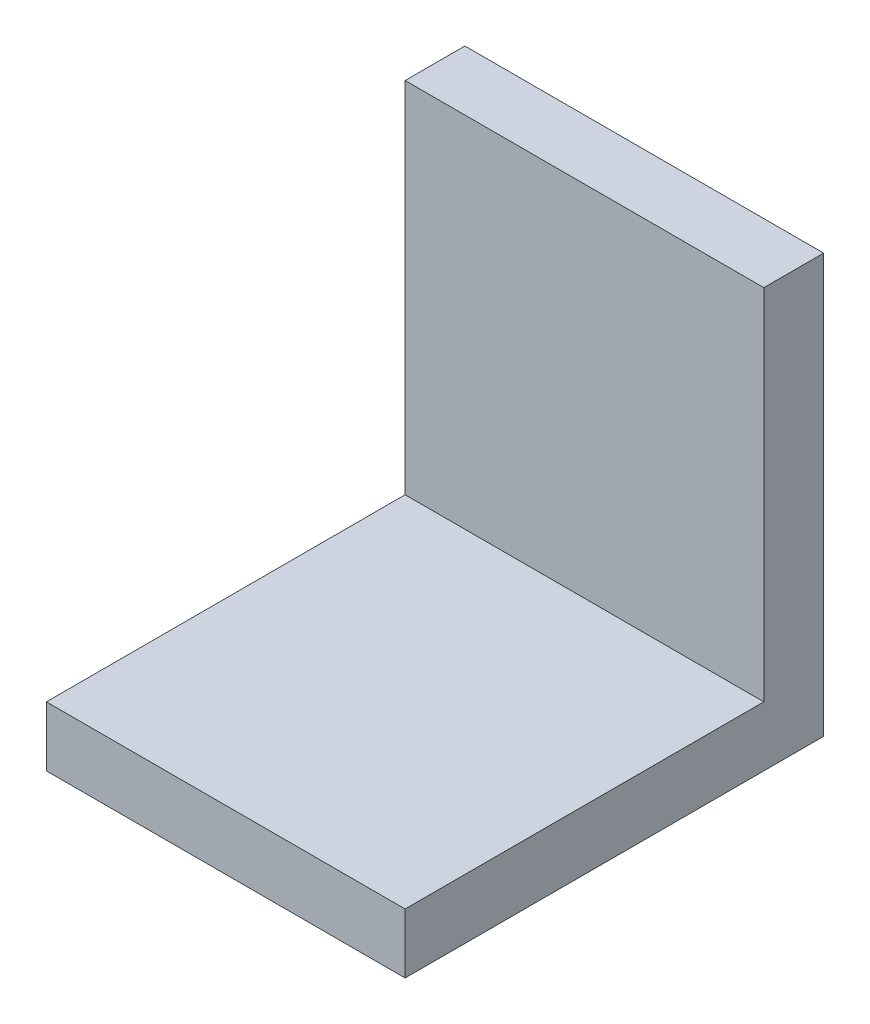
from build123d import *

# Parameters (mm, degrees)
BOSS_EXTRUDE1_DEPTH = 30


with BuildPart() as part:
    # Sketch1 → Boss-Extrude1 (new body)
    with BuildSketch(Plane(origin=(0, 0, 0), x_dir=(0, 0, -1), z_dir=(1, 0, 0))):
        Polygon((0, 0), (-35, 0), (-35, 5), (-5, 5), (-5, 35), (0, 35), align=None)
    extrude(amount=BOSS_EXTRUDE1_DEPTH)


solid = part.part
